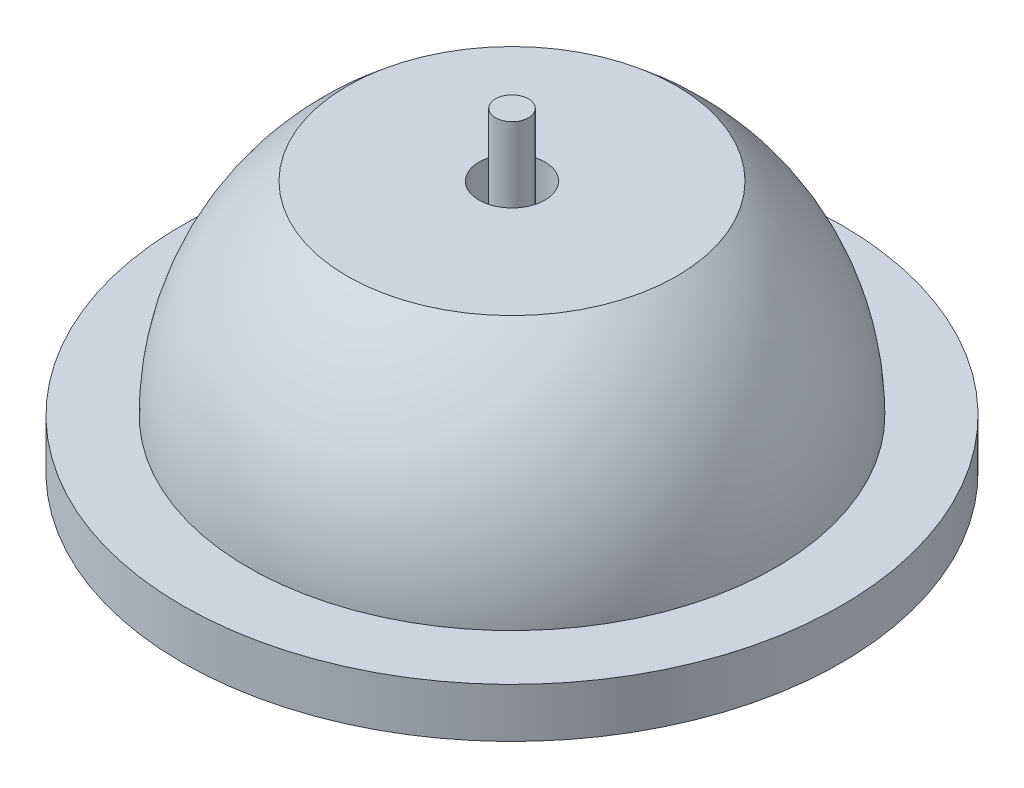
from build123d import *

# Parameters (mm, degrees)
SKETCH5_W = 10
SKETCH5_H = 85.271317829
SKETCH6_W = 4.997404457
SKETCH6_H = 99.86379845


with BuildPart() as part:
    # Sketch1 → Revolve1 (revolve)
    with BuildSketch(Plane.XY, mode=Mode.PRIVATE) as revolve1_sk:
        with BuildLine():
            Line((0, 0), (-100, 0))
            Line((-100, 0), (-100, 15))
            Line((-100, 15), (-80, 15))
            ThreePointArc((-80, 15), (-72.100884338, 49.242047033), (-50, 76.563553666))
            Line((-50, 76.563553666), (0, 76.563553666))
            Line((0, 76.563553666), (0, 0))
        make_face()
    revolve(revolve1_sk.sketch.rotate(Axis((0, -54.430062581, 0), (0, 1, 0)), 270), axis=Axis((0, -54.430062581, 0), (0, 1, 0)))

    # Sketch5 → Cut-Revolve3 (revolve, cut)
    with BuildSketch(Plane.XY, mode=Mode.PRIVATE) as cut_revolve3_sk:
        with Locations((-5, 38.0233789)):
            Rectangle(SKETCH5_W, SKETCH5_H)
    revolve(cut_revolve3_sk.sketch.rotate(Axis((0, -4.612280014, 0), (0, 1, 0)), 270), axis=Axis((0, -4.612280014, 0), (0, 1, 0)), mode=Mode.SUBTRACT)

    # Sketch8 → Cut-Revolve5 (revolve, cut)
    with BuildSketch(Plane.XY, mode=Mode.PRIVATE) as cut_revolve5_sk:
        with BuildLine():
            Line((16.403662065, 15), (49.788533995, 15))
            add(Edge.make_bspline(
                [(49.788533995, 15), (35.987773119, 19.719088146), (16.403662065, 19.226251336), (16.403662065, 15)],
                knots=[0, 0, 0, 0, 1, 1, 1, 1], degree=3))
        make_face()
    revolve(cut_revolve5_sk.sketch.rotate(Axis((0, -28.203653135, 0), (0, 1, 0)), 90), axis=Axis((0, -28.203653135, 0), (0, 1, 0)), mode=Mode.SUBTRACT)


with BuildPart() as body_2:
    # Sketch6 → Revolve5 (revolve)
    with BuildSketch(Plane.XY, mode=Mode.PRIVATE) as revolve5_sk:
        with Locations((-2.498702229, 45.752792466)):
            Rectangle(SKETCH6_W, SKETCH6_H)
    revolve(revolve5_sk.sketch.rotate(Axis((0, -4.179106759, 0), (0, 1, 0)), 270), axis=Axis((0, -4.179106759, 0), (0, 1, 0)))

    # Sketch7 → Revolve7 (revolve)
    with BuildSketch(Plane.XY, mode=Mode.PRIVATE) as revolve7_sk:
        with BuildLine():
            Line((0, -4.179106759), (-15.643341922, -4.179106759))
            add(Edge.make_bspline(
                [(-15.643341922, -4.179106759), (0, -19.729897602), (-13.066129302, -24.878518685), (0, -19.729897602)],
                knots=[0, 0, 0, 0, 1, 1, 1, 1], degree=3))
            Line((0, -19.729897602), (0, -4.179106759))
        make_face()
    revolve(revolve7_sk.sketch.rotate(Axis((0, -28.203653135, 0), (0, 1, 0)), 270), axis=Axis((0, -28.203653135, 0), (0, 1, 0)))


solid = Compound([part.part, body_2.part])
